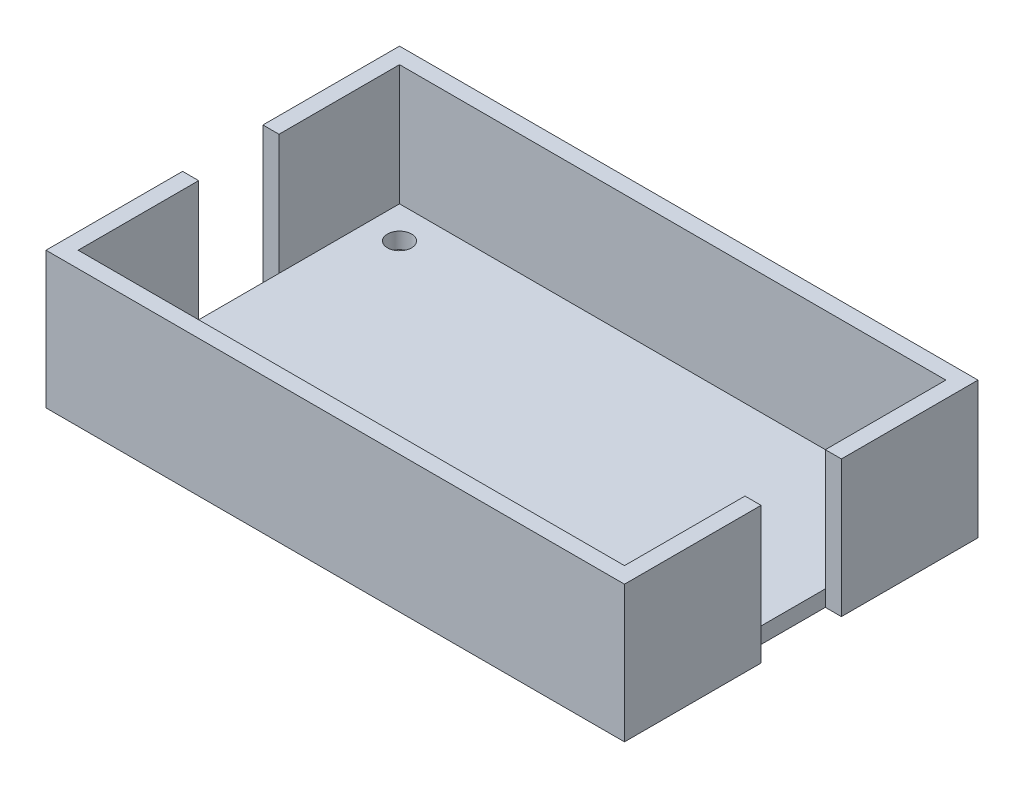
from build123d import *

# Parameters (mm, degrees)
SKETCH_2_W          = 72
SKETCH_2_H          = 44
SKETCH_2_W_2        = 68
SKETCH_2_H_2        = 40
EXTRUDE_1_DEPTH     = 15
SKETCH_2_3_W        = 72
SKETCH_2_3_H        = 44
SKETCH_2_3_R        = 1.5
EXTRUDE_2_DEPTH     = 2
SKETCH_4_W          = 10
SKETCH_4_H          = 17
CUT_EXTRUDE_1_DEPTH = 2
SKETCH_5_W          = 10
SKETCH_5_H          = 17
CUT_EXTRUDE_2_DEPTH = 2


with BuildPart() as part:
    # 草图2 → 凸台-拉伸1 (new body)
    with BuildSketch(Plane(origin=(0, 0, 0), x_dir=(1, 0, 0), z_dir=(0, 1, 0))):
        with Locations((36, -22)):
            Rectangle(SKETCH_2_W, SKETCH_2_H)
        with Locations((36, -22)):
            Rectangle(SKETCH_2_W_2, SKETCH_2_H_2, mode=Mode.SUBTRACT)
    extrude(amount=EXTRUDE_1_DEPTH)

    # 草图2<3> → 凸台-拉伸2 (add)
    with BuildSketch(Plane(origin=(0, 0, 0), x_dir=(1, 0, 0), z_dir=(0, 1, 0))):
        with Locations((36, -22)):
            Rectangle(SKETCH_2_3_W, SKETCH_2_3_H)
        with Locations((6, -38)):
            Circle(SKETCH_2_3_R, mode=Mode.SUBTRACT)
        with Locations((66, -38)):
            Circle(SKETCH_2_3_R, mode=Mode.SUBTRACT)
        with Locations((6, -6)):
            Circle(SKETCH_2_3_R, mode=Mode.SUBTRACT)
        with Locations((66, -6)):
            Circle(SKETCH_2_3_R, mode=Mode.SUBTRACT)
    extrude(amount=-EXTRUDE_2_DEPTH)

    # 草图4 → 切除-拉伸1 (cut)
    with BuildSketch(Plane.ZY):
        with Locations((22, 6.5)):
            Rectangle(SKETCH_4_W, SKETCH_4_H)
    extrude(amount=-CUT_EXTRUDE_1_DEPTH, mode=Mode.SUBTRACT)

    # 草图5 → 切除-拉伸2 (cut)
    with BuildSketch(Plane(origin=(72, 0, 0), x_dir=(0, 0, -1), z_dir=(1, 0, 0))):
        with Locations((-22, 6.5)):
            Rectangle(SKETCH_5_W, SKETCH_5_H)
    extrude(amount=-CUT_EXTRUDE_2_DEPTH, mode=Mode.SUBTRACT)


solid = part.part
